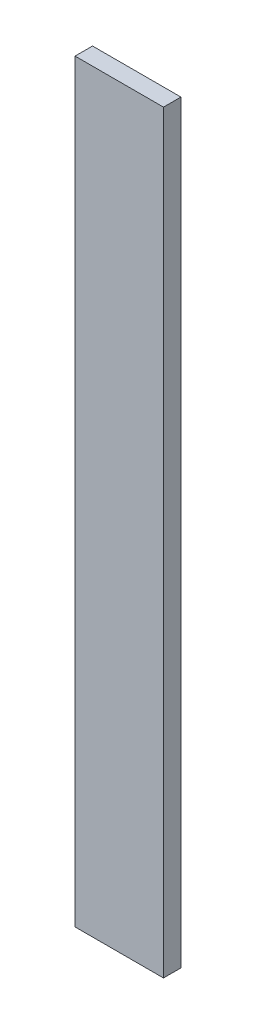
from build123d import *

# Parameters (mm, degrees)
SKETCH1_W           = 96.52
SKETCH1_H           = 823.3664
BOSS_EXTRUDE1_DEPTH = 19.05


with BuildPart() as part:
    # Sketch1 → Boss-Extrude1 (new body)
    with BuildSketch(Plane.XY):
        with Locations((1779.789510309, 2358.667877479)):
            Rectangle(SKETCH1_W, SKETCH1_H)
    extrude(amount=BOSS_EXTRUDE1_DEPTH)


solid = part.part
